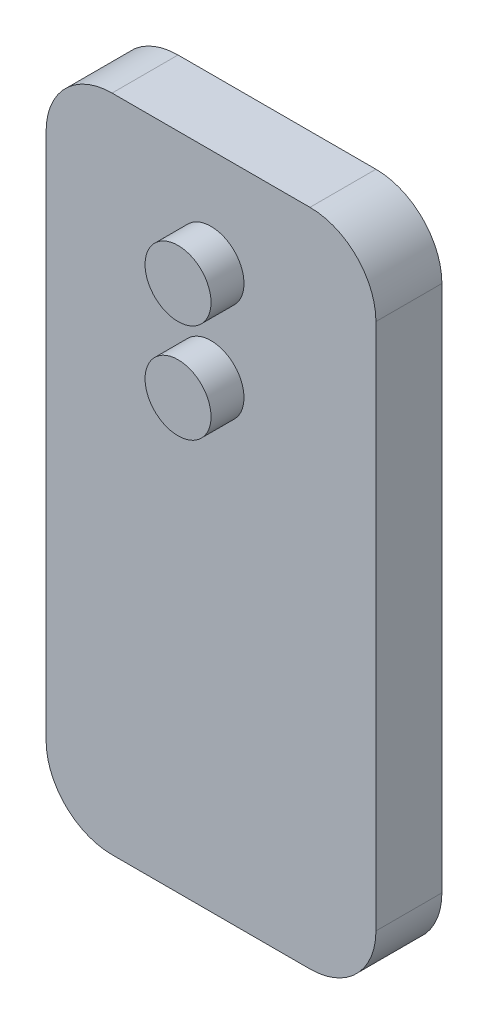
from build123d import *

# Parameters (mm, degrees)
BOSS_EXTRU_1_DEPTH = 10
ESQUISSE2_R        = 5
BOSS_EXTRU_2_DEPTH = 5


with BuildPart() as part:
    # Esquisse1 → Boss.-Extru.1 (new body)
    with BuildSketch(Plane.XY):
        with BuildLine():
            Line((-15, 0), (15, 0))
            ThreePointArc((15, 0), (22.071067812, 2.928932188), (25, 10))
            Line((25, 10), (25, 90))
            ThreePointArc((25, 90), (22.071067812, 97.071067812), (15, 100))
            Line((15, 100), (-15, 100))
            ThreePointArc((-15, 100), (-22.071067812, 97.071067812), (-25, 90))
            Line((-25, 90), (-25, 10))
            ThreePointArc((-25, 10), (-22.071067812, 2.928932188), (-15, 0))
        make_face()
    extrude(amount=BOSS_EXTRU_1_DEPTH)

    # Esquisse2 → Boss.-Extru.2 (add)
    with BuildSketch(Plane.XY.offset(10)):
        with Locations(Location((0, 85, 0), (0, 0, 180))):
            Circle(ESQUISSE2_R)
        with Locations(Location((0, 70, 0), (0, 0, 180))):
            Circle(ESQUISSE2_R)
    extrude(amount=BOSS_EXTRU_2_DEPTH)


solid = part.part
